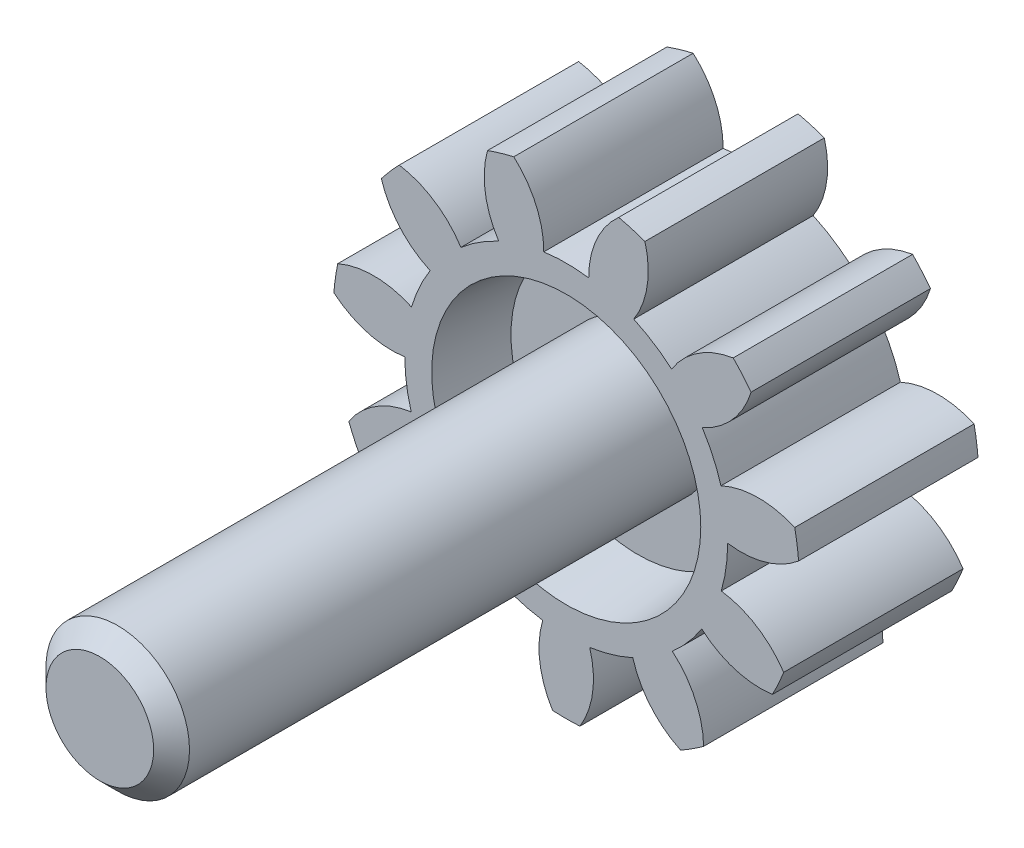
from build123d import *

# Parameters (mm, degrees)
SKETCH_1_R               = 13
EXTRUDE_1_DEPTH          = 10
CUT_EXTRUDE_START        = -10
CUT_EXTRUDE_1_DEPTH      = 10
PATTERN_CIRCULAR_3_COUNT = 11
SKETCH_3_R               = 7.5
CUT_EXTRUDE_2_DEPTH      = 4
CUT_EXTRUDE_2_DRAFT      = -6
SKETCH_4_R               = 7.5
CUT_EXTRUDE_3_DEPTH      = 4
CUT_EXTRUDE_3_DRAFT      = -6
SKETCH_5_R               = 4
EXTRUDE_2_DEPTH          = 30
CHAMFER_1_SIZE           = 1


with BuildPart() as part:
    # Эскиз1 → Бобышка-Вытянуть1 (new body)
    with BuildSketch(Plane.XY):
        Circle(SKETCH_1_R)
    extrude(amount=EXTRUDE_1_DEPTH)

    # Эскиз2 → Вырез-Вытянуть1 (cut)
    with BuildSketch(Plane.XY.offset(10).offset(CUT_EXTRUDE_START)):
        with BuildLine():
            ThreePointArc((1.252557909, 8.912412619), (0, 9), (-1.252557909, 8.912412619))
            ThreePointArc((-1.252557909, 8.912412619), (-1.684886314, 10.969320472), (-2.924363706, 12.666810842))
            ThreePointArc((-2.924363706, 12.666810842), (0, 13), (2.924363706, 12.666810842))
            ThreePointArc((2.924363706, 12.666810842), (1.684886314, 10.969320472), (1.252557909, 8.912412619))
        make_face()
    cut_extrude_1 = extrude(amount=CUT_EXTRUDE_1_DEPTH, mode=Mode.SUBTRACT)

    # Круговой массив3: Вырез-Вытянуть1 ×11 about axis
    pattern_circular_3_axis = Axis((0, 0, 0), (0, 0, 1))
    for i in range(1, PATTERN_CIRCULAR_3_COUNT):
        add(cut_extrude_1.rotate(pattern_circular_3_axis, i * 360 / PATTERN_CIRCULAR_3_COUNT), mode=Mode.SUBTRACT)


with BuildPart() as cut_extrude_2_tool:
    # Эскиз3 → Вырез-Вытянуть2 (with draft: the straight prism first)
    with BuildSketch(Plane.XY.offset(10)):
        Circle(SKETCH_3_R)
    extrude(amount=-CUT_EXTRUDE_2_DEPTH)
    # Вырез-Вытянуть2: the draft: its side faces are tilted about the plane it starts from
    cut_extrude_2_sides = [cut_extrude_2_tool.faces().sort_by_distance(p)[0] for p in [
        (-7.5, 0, 8),
    ]]
    draft(cut_extrude_2_sides, Plane.XY.offset(10), CUT_EXTRUDE_2_DRAFT)


with BuildPart() as part_1:
    add(part.part)

    # Вырез-Вытянуть2: cut by cut_extrude_2_tool
    add(cut_extrude_2_tool.part, mode=Mode.SUBTRACT)


with BuildPart() as cut_extrude_3_tool:
    # Эскиз4 → Вырез-Вытянуть3 (with draft: the straight prism first)
    with BuildSketch(Plane(origin=(0, 0, 0), x_dir=(-1, 0, 0), z_dir=(0, 0, -1))):
        Circle(SKETCH_4_R)
    extrude(amount=-CUT_EXTRUDE_3_DEPTH)
    # Вырез-Вытянуть3: the draft: its side faces are tilted about the plane it starts from
    cut_extrude_3_sides = [cut_extrude_3_tool.faces().sort_by_distance(p)[0] for p in [
        (7.5, 0, 2),
    ]]
    draft(cut_extrude_3_sides, Plane(origin=(0, 0, 0), x_dir=(-1, 0, 0), z_dir=(0, 0, -1)), CUT_EXTRUDE_3_DRAFT)


with BuildPart() as part_2:
    add(part_1.part)

    # Вырез-Вытянуть3: cut by cut_extrude_3_tool
    add(cut_extrude_3_tool.part, mode=Mode.SUBTRACT)

    # Эскиз5 → Бобышка-Вытянуть2 (add)
    with BuildSketch(Plane.XY.offset(6)):
        Circle(SKETCH_5_R)
    extrude(amount=EXTRUDE_2_DEPTH)

    # Фаска1
    chamfer_1_edges = [part_2.edges().sort_by_distance(p)[0] for p in [
        (-4, 0, 36),
    ]]
    chamfer(chamfer_1_edges, length=CHAMFER_1_SIZE)


solid = part_2.part
